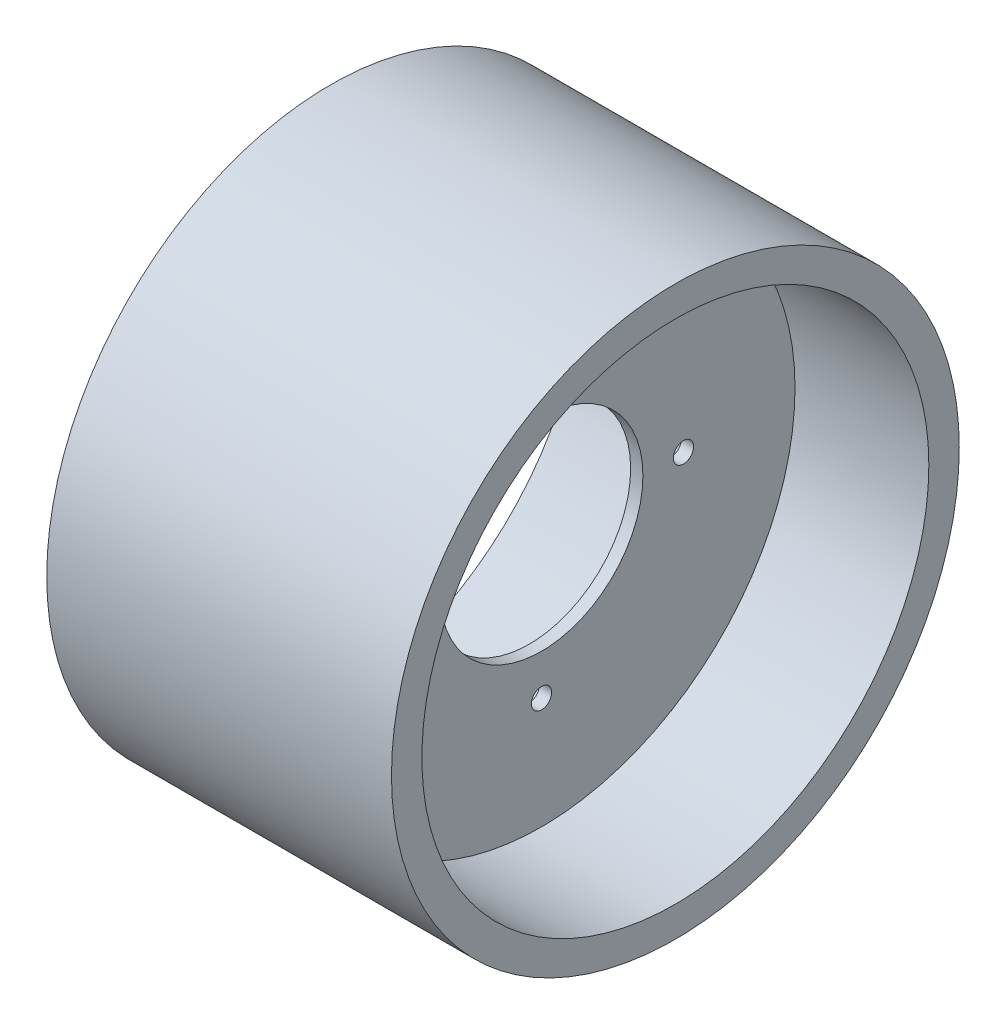
from build123d import *

# Parameters (mm, degrees)
SCALE1_SCALE            = 10
CUT_EXTRUDE1_DEPTH      = 10
CUT_EXTRUDE1_DEPTH_BACK = 10
SKETCH4_R               = 5


with BuildPart() as part:
    # Sketch1 → Revolve1 (revolve)
    with BuildSketch(Plane.XY, mode=Mode.PRIVATE) as revolve1_sk:
        Polygon((-22.439160201, 47.327777778), (-22.439160201, 45.464860395), (-21.56053595, 45.464860395), (-21.56053595, 39.827777778), (-20.955555556, 39.827777778), (-20.955555556, 47.327777778), (-14.355555556, 47.327777778), (-14.355555556, 48.827777778), (-31.355555556, 48.827777778), (-31.355555556, 47.327777778), align=None)
    revolve(revolve1_sk.sketch.rotate(Axis((-14.355555556, 34.827777778, 0), (-1, 0, 0)), 90), axis=Axis((-14.355555556, 34.827777778, 0), (-1, 0, 0)))


with BuildPart() as part_1:
    # Scale1: scaled about (-22.654736369, 34.827777778, 0)
    add(part.part.scale(SCALE1_SCALE).moved(Location((203.892627321, -313.450000002, 0))))

    # Sketch4 → Cut-Extrude1 (cut, two sides: drawn at the far end of the back side and taken through both)
    with BuildSketch(Plane.ZY.offset(11.712732179).offset(-CUT_EXTRUDE1_DEPTH_BACK)):
        with Locations(Location((-70, 34.827777778, 0), (0, 0, 180))):
            Circle(SKETCH4_R)
        with Locations(Location((0, 104.827777778, 0), (0, 0, 180))):
            Circle(SKETCH4_R)
        with Locations(Location((70, 34.827777778, 0), (0, 0, 180))):
            Circle(SKETCH4_R)
        with Locations(Location((0, -35.172222222, 0), (0, 0, 180))):
            Circle(SKETCH4_R)
    extrude(amount=CUT_EXTRUDE1_DEPTH + CUT_EXTRUDE1_DEPTH_BACK, mode=Mode.SUBTRACT)


solid = part_1.part
